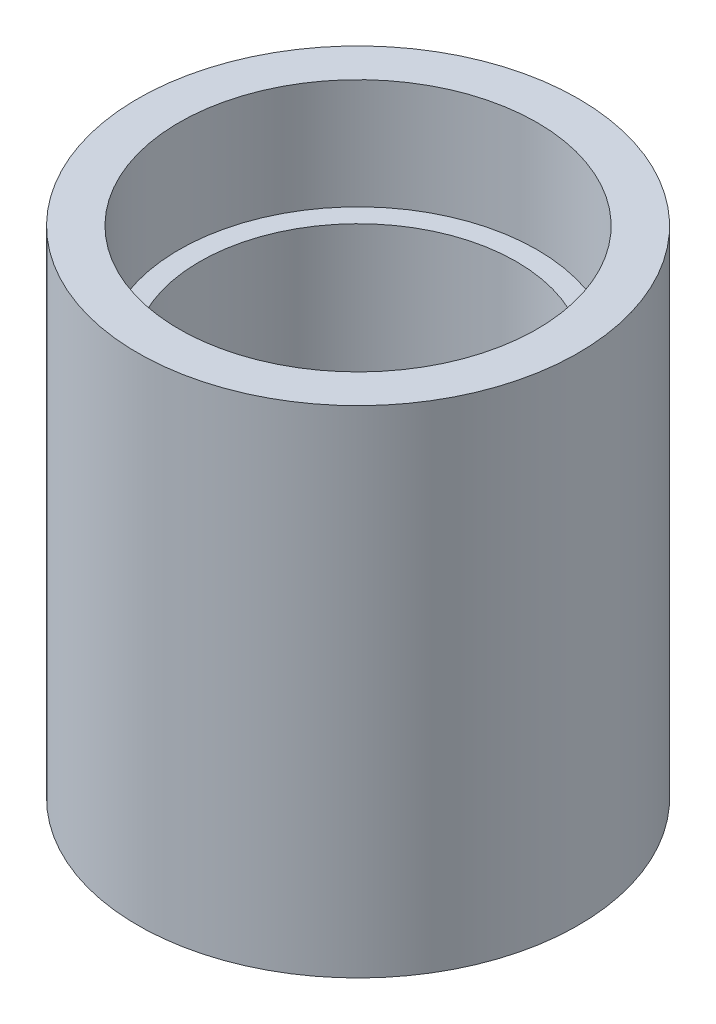
from build123d import *


with BuildPart() as part:
    # Croquis1 → Revolución1 (revolve)
    with BuildSketch(Plane.XY, mode=Mode.PRIVATE) as revoluci_n1_sk:
        Polygon((-13, 67.989509587), (-16, 67.989509587), (-16, 31.989509587), (-13, 31.989509587), (-13, 39.989509587), (-11.5, 39.989509587), (-11.5, 59.989509587), (-13, 59.989509587), align=None)
    revolve(revoluci_n1_sk.sketch.rotate(Axis((0, 0, 0), (0, 1, 0)), 270), axis=Axis((0, 0, 0), (0, 1, 0)))


solid = part.part
